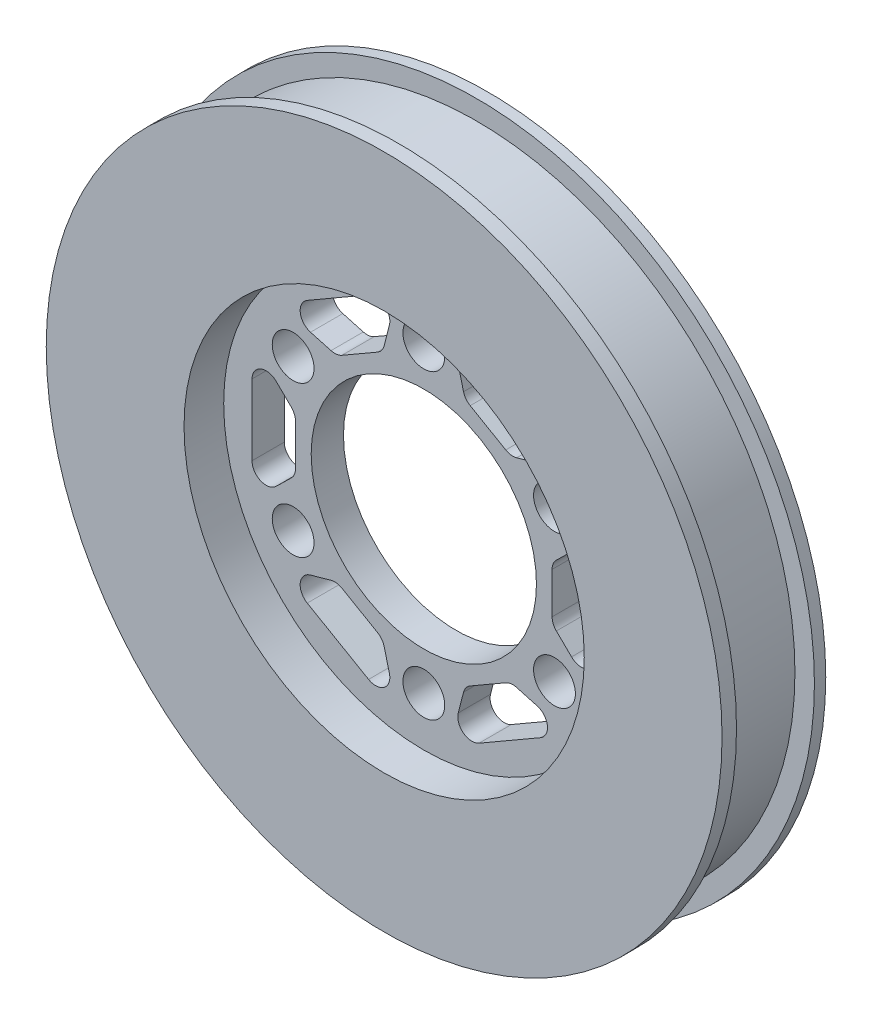
from build123d import *

# Parameters (mm, degrees)
SCHIZZO1_R                   = 23.85
ESTRUSIONE_ESTRUSIONE1_DEPTH = 0.8
SCHIZZO2_R                   = 22.475
ESTRUSIONE_ESTRUSIONE2_DEPTH = 5.5
SCHIZZO3_R                   = 23.85
ESTRUSIONE_ESTRUSIONE3_DEPTH = 1.02
SCHIZZO4_R                   = 20.665
TAGLIO_ESTRUSIONE1_DEPTH     = 1.27
SCHIZZO5_R                   = 16.975
TAGLIO_ESTRUSIONE2_DEPTH     = 0.97
SCHIZZO6_R                   = 7.95
TAGLIO_ESTRUSIONE3_DEPTH     = 35.109403396
SCHIZZO7_R                   = 14.125
TAGLIO_ESTRUSIONE4_DEPTH     = 2.8
SCHIZZO10_R                  = 1.475
TAGLIO_ESTRUSIONE5_DEPTH     = 35.109403396


with BuildPart() as part:
    # Schizzo1 → Estrusione-Estrusione1 (new body)
    with BuildSketch(Plane.XY):
        Circle(SCHIZZO1_R)
    extrude(amount=ESTRUSIONE_ESTRUSIONE1_DEPTH)

    # Schizzo2 → Estrusione-Estrusione2 (add)
    with BuildSketch(Plane.XY.offset(0.8)):
        Circle(SCHIZZO2_R)
    extrude(amount=ESTRUSIONE_ESTRUSIONE2_DEPTH)

    # Schizzo3 → Estrusione-Estrusione3 (add)
    with BuildSketch(Plane.XY.offset(6.3)):
        Circle(SCHIZZO3_R)
    extrude(amount=ESTRUSIONE_ESTRUSIONE3_DEPTH)

    # Schizzo4 → Taglio-Estrusione1 (cut)
    with BuildSketch(Plane(origin=(0, 0, 0), x_dir=(-1, 0, 0), z_dir=(0, 0, -1))):
        Circle(SCHIZZO4_R)
    extrude(amount=-TAGLIO_ESTRUSIONE1_DEPTH, mode=Mode.SUBTRACT)

    # Schizzo5 → Taglio-Estrusione2 (cut)
    with BuildSketch(Plane(origin=(0, 0, 1.27), x_dir=(-1, 0, 0), z_dir=(0, 0, -1))):
        Circle(SCHIZZO5_R)
    extrude(amount=-TAGLIO_ESTRUSIONE2_DEPTH, mode=Mode.SUBTRACT)

    # Schizzo6 → Taglio-Estrusione3 (cut, through all)
    with BuildSketch(Plane(origin=(0, 0, 2.24), x_dir=(-1, 0, 0), z_dir=(0, 0, -1))):
        Circle(SCHIZZO6_R)
    extrude(amount=-TAGLIO_ESTRUSIONE3_DEPTH, mode=Mode.SUBTRACT)

    # Schizzo7 → Taglio-Estrusione4 (cut)
    with BuildSketch(Plane.XY.offset(7.32)):
        Circle(SCHIZZO7_R)
    extrude(amount=-TAGLIO_ESTRUSIONE4_DEPTH, mode=Mode.SUBTRACT)

    # Schizzo10 → Taglio-Estrusione5 (cut, through all)
    with BuildSketch(Plane(origin=(0, 0, 2.24), x_dir=(-1, 0, 0), z_dir=(0, 0, -1))):
        with Locations((0, 10.65)):
            Circle(SCHIZZO10_R)
        with Locations((9.22317055, 5.325)):
            Circle(SCHIZZO10_R)
        with Locations((9.22317055, -5.325)):
            Circle(SCHIZZO10_R)
        with Locations((0, -10.65)):
            Circle(SCHIZZO10_R)
        with Locations((-9.22317055, -5.325)):
            Circle(SCHIZZO10_R)
        with Locations((-9.22317055, 5.325)):
            Circle(SCHIZZO10_R)
        with BuildLine():
            Line((-12.12588027, 2.5), (-12.12588027, -2.5))
            ThreePointArc((-12.12588027, -2.5), (-11.513178605, -3.421954446), (-10.42588027, -3.214142843))
            Line((-10.42588027, -3.214142843), (-9.354666006, -2.164142843))
            ThreePointArc((-9.354666006, -2.164142843), (-9.13271156, -1.837298335), (-9.054666006, -1.45))
            Line((-9.054666006, -1.45), (-9.054666006, 1.45))
            ThreePointArc((-9.054666006, 1.45), (-9.13271156, 1.837298335), (-9.354666006, 2.164142843))
            Line((-9.354666006, 2.164142843), (-10.42588027, 3.214142843))
            ThreePointArc((-10.42588027, 3.214142843), (-11.513178605, 3.421954446), (-12.12588027, 2.5))
        make_face()
        with BuildLine():
            Line((-2.429410782, 10.636148592), (-2.803130324, 9.183449827))
            ThreePointArc((-2.803130324, 9.183449827), (-2.975208748, 8.827809384), (-3.271596168, 8.566570784))
            Line((-3.271596168, 8.566570784), (-5.783069839, 7.116570784))
            ThreePointArc((-5.783069839, 7.116570784), (-6.157502812, 6.990511049), (-6.551535682, 7.019306984))
            Line((-6.551535682, 7.019306984), (-7.996469488, 7.42200575))
            ThreePointArc((-7.996469488, 7.42200575), (-8.720088783, 8.259727927), (-8.228003645, 9.251320357))
            Line((-8.228003645, 9.251320357), (-3.897876626, 11.751320357))
            ThreePointArc((-3.897876626, 11.751320357), (-2.793089822, 11.681682373), (-2.429410782, 10.636148592))
        make_face()
        with BuildLine():
            Line((7.996469488, 7.42200575), (6.551535682, 7.019306984))
            ThreePointArc((6.551535682, 7.019306984), (6.157502812, 6.990511049), (5.783069839, 7.116570784))
            Line((5.783069839, 7.116570784), (3.271596168, 8.566570784))
            ThreePointArc((3.271596168, 8.566570784), (2.975208748, 8.827809384), (2.803130324, 9.183449827))
            Line((2.803130324, 9.183449827), (2.429410782, 10.636148592))
            ThreePointArc((2.429410782, 10.636148592), (2.793089822, 11.681682373), (3.897876626, 11.751320357))
            Line((3.897876626, 11.751320357), (8.228003645, 9.251320357))
            ThreePointArc((8.228003645, 9.251320357), (8.720088783, 8.259727927), (7.996469488, 7.42200575))
        make_face()
        with BuildLine():
            Line((10.42588027, -3.214142843), (9.354666006, -2.164142843))
            ThreePointArc((9.354666006, -2.164142843), (9.13271156, -1.837298335), (9.054666006, -1.45))
            Line((9.054666006, -1.45), (9.054666006, 1.45))
            ThreePointArc((9.054666006, 1.45), (9.13271156, 1.837298335), (9.354666006, 2.164142843))
            Line((9.354666006, 2.164142843), (10.42588027, 3.214142843))
            ThreePointArc((10.42588027, 3.214142843), (11.513178605, 3.421954446), (12.12588027, 2.5))
            Line((12.12588027, 2.5), (12.12588027, -2.5))
            ThreePointArc((12.12588027, -2.5), (11.513178605, -3.421954446), (10.42588027, -3.214142843))
        make_face()
        with BuildLine():
            Line((2.429410782, -10.636148592), (2.803130324, -9.183449827))
            ThreePointArc((2.803130324, -9.183449827), (2.975208748, -8.827809384), (3.271596168, -8.566570784))
            Line((3.271596168, -8.566570784), (5.783069839, -7.116570784))
            ThreePointArc((5.783069839, -7.116570784), (6.157502812, -6.990511049), (6.551535682, -7.019306984))
            Line((6.551535682, -7.019306984), (7.996469488, -7.42200575))
            ThreePointArc((7.996469488, -7.42200575), (8.720088783, -8.259727927), (8.228003645, -9.251320357))
            Line((8.228003645, -9.251320357), (3.897876626, -11.751320357))
            ThreePointArc((3.897876626, -11.751320357), (2.793089822, -11.681682373), (2.429410782, -10.636148592))
        make_face()
        with BuildLine():
            Line((-7.996469488, -7.42200575), (-6.551535682, -7.019306984))
            ThreePointArc((-6.551535682, -7.019306984), (-6.157502812, -6.990511049), (-5.783069839, -7.116570784))
            Line((-5.783069839, -7.116570784), (-3.271596168, -8.566570784))
            ThreePointArc((-3.271596168, -8.566570784), (-2.975208748, -8.827809384), (-2.803130324, -9.183449827))
            Line((-2.803130324, -9.183449827), (-2.429410782, -10.636148592))
            ThreePointArc((-2.429410782, -10.636148592), (-2.793089822, -11.681682373), (-3.897876626, -11.751320357))
            Line((-3.897876626, -11.751320357), (-8.228003645, -9.251320357))
            ThreePointArc((-8.228003645, -9.251320357), (-8.720088783, -8.259727927), (-7.996469488, -7.42200575))
        make_face()
    extrude(amount=-TAGLIO_ESTRUSIONE5_DEPTH, mode=Mode.SUBTRACT)


solid = part.part
